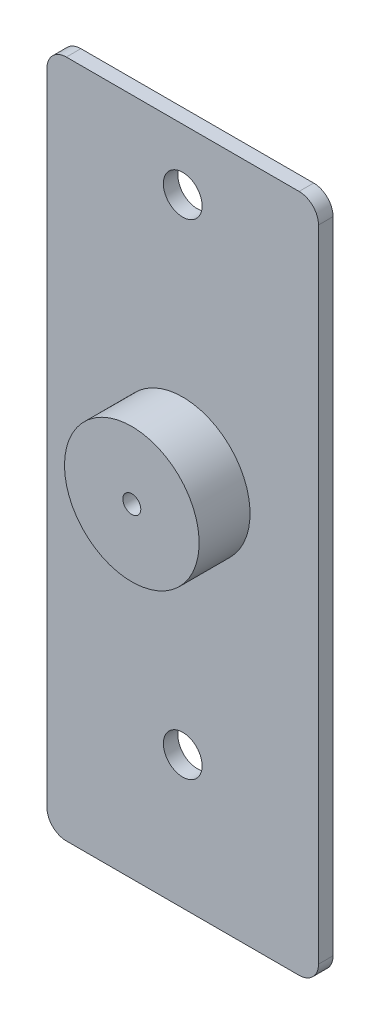
from build123d import *

# Parameters (mm, degrees)
SKETCH1_W           = 28
SKETCH1_H           = 70
BOSS_EXTRUDE1_DEPTH = 1.5
SKETCH3_R           = 6.941493401
BOSS_EXTRUDE2_DEPTH = 5.25
SKETCH2_R           = 2
SKETCH2_R_2         = 0.925
CUT_EXTRUDE1_DEPTH  = 39.295724304
FILLET1_R           = 2


with BuildPart() as part:
    # Sketch1 → Boss-Extrude1 (new body)
    with BuildSketch(Plane.XY):
        Rectangle(SKETCH1_W, SKETCH1_H)
    extrude(amount=-BOSS_EXTRUDE1_DEPTH)

    # Sketch3 → Boss-Extrude2 (add)
    with BuildSketch(Plane.XY):
        with Locations(Location((0, 3.703561495, 0), (0, 0, 180))):
            Circle(SKETCH3_R)
    extrude(amount=BOSS_EXTRUDE2_DEPTH)

    # Sketch2 → Cut-Extrude1 (cut, through all)
    with BuildSketch(Plane(origin=(0, 0, -1.5), x_dir=(-1, 0, 0), z_dir=(0, 0, -1))):
        with Locations((0.000493893, -21.295000553)):
            Circle(SKETCH2_R)
        with Locations((0.000493654, 28.705001831)):
            Circle(SKETCH2_R)
        with Locations((0, 3.703561495)):
            Circle(SKETCH2_R_2)
    extrude(amount=-CUT_EXTRUDE1_DEPTH, mode=Mode.SUBTRACT)

    # Fillet1
    fillet1_edges = [part.edges().sort_by_distance(p)[0] for p in [
        (14, 35, -0.75),
        (-14, 35, -0.75),
        (-14, -35, -0.75),
        (14, -35, -0.75),
    ]]
    fillet(fillet1_edges, radius=FILLET1_R)


solid = part.part
